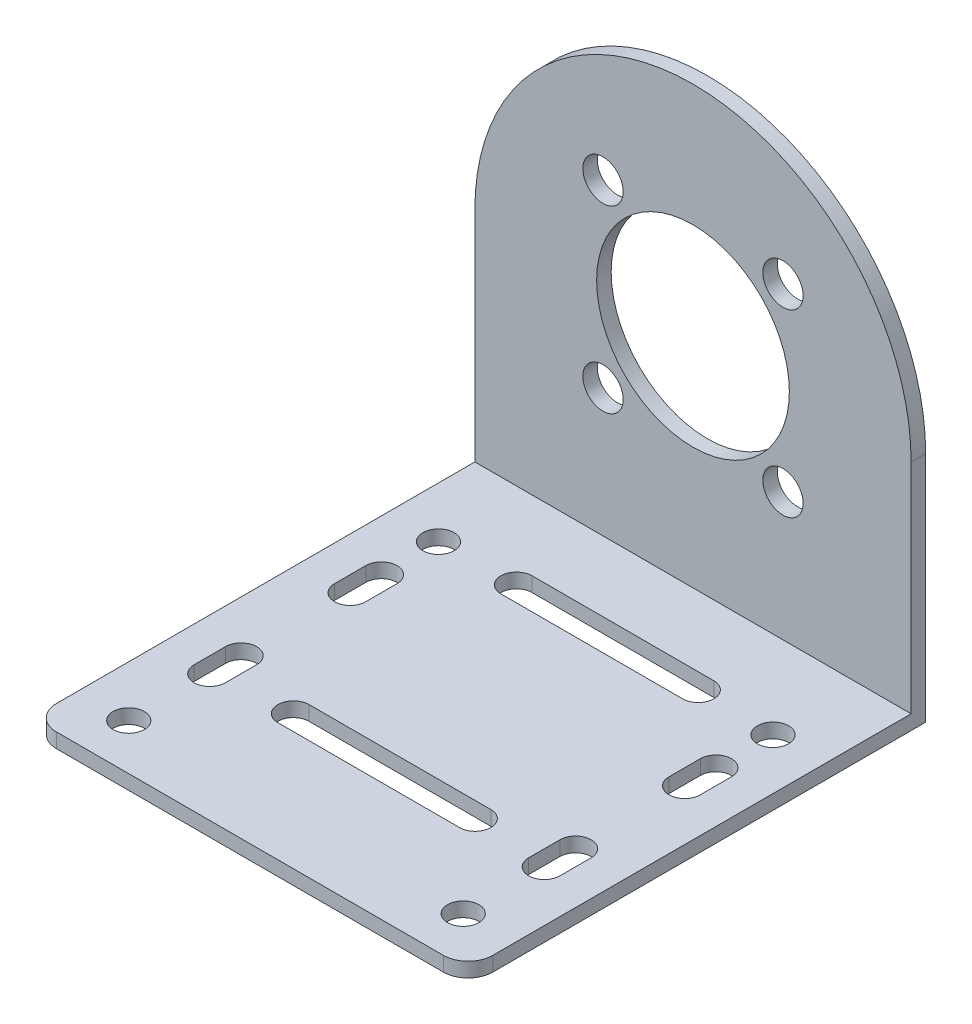
from build123d import *

# Parameters (mm, degrees)
SKETCH1_R           = 2.15
BOSS_EXTRUDE1_DEPTH = 2
SKETCH5_R           = 2.774437445
SKETCH5_R_2         = 13.25
BOSS_EXTRUDE2_DEPTH = 2


with BuildPart() as part:
    # Sketch1 → Boss-Extrude1 (new body)
    with BuildSketch(Plane(origin=(0, 0, 0), x_dir=(1, 0, 0), z_dir=(0, 1, 0))):
        with BuildLine():
            Line((-26.604565316, -31.465), (26.604565316, -31.465))
            ThreePointArc((26.604565316, -31.465), (29.005500206, -30.470500206), (30, -28.069565316))
            Line((30, -28.069565316), (30, 31.465))
            Line((30, 31.465), (-30, 31.465))
            Line((-30, 31.465), (-30, -28.069565316))
            ThreePointArc((-30, -28.069565316), (-29.005500206, -30.470500206), (-26.604565316, -31.465))
        make_face()
        with Locations(Location((-23, -25.135, 0), (0, 0, 270))):
            Circle(SKETCH1_R, mode=Mode.SUBTRACT)
        with Locations(Location((-23, 17.465, 0), (0, 0, 270))):
            Circle(SKETCH1_R, mode=Mode.SUBTRACT)
        with Locations(Location((23, -25.135, 0), (0, 0, 90))):
            Circle(SKETCH1_R, mode=Mode.SUBTRACT)
        with Locations(Location((23, 17.465, 0), (0, 0, 90))):
            Circle(SKETCH1_R, mode=Mode.SUBTRACT)
        with BuildLine():
            Line((-12.5, 19.838201533), (12.5, 19.838201533))
            ThreePointArc((12.5, 19.838201533), (14.65, 17.688201533), (12.5, 15.538201533))
            Line((12.5, 15.538201533), (-12.5, 15.538201533))
            ThreePointArc((-12.5, 15.538201533), (-14.65, 17.688201533), (-12.5, 19.838201533))
        make_face(mode=Mode.SUBTRACT)
        with BuildLine():
            Line((-20.85, 9.615), (-20.85, 5.315))
            ThreePointArc((-20.85, 5.315), (-23, 3.165), (-25.15, 5.315))
            Line((-25.15, 5.315), (-25.15, 9.615))
            ThreePointArc((-25.15, 9.615), (-23, 11.765), (-20.85, 9.615))
        make_face(mode=Mode.SUBTRACT)
        with BuildLine():
            Line((-20.85, -9.685), (-20.85, -13.985))
            ThreePointArc((-20.85, -13.985), (-23, -16.135), (-25.15, -13.985))
            Line((-25.15, -13.985), (-25.15, -9.685))
            ThreePointArc((-25.15, -9.685), (-23, -7.535), (-20.85, -9.685))
        make_face(mode=Mode.SUBTRACT)
        with BuildLine():
            Line((-12.5, -10.835), (12.5, -10.835))
            ThreePointArc((12.5, -10.835), (14.65, -12.985), (12.5, -15.135))
            Line((12.5, -15.135), (-12.5, -15.135))
            ThreePointArc((-12.5, -15.135), (-14.65, -12.985), (-12.5, -10.835))
        make_face(mode=Mode.SUBTRACT)
        with BuildLine():
            Line((20.85, -9.685), (20.85, -13.985))
            ThreePointArc((20.85, -13.985), (23, -16.135), (25.15, -13.985))
            Line((25.15, -13.985), (25.15, -9.685))
            ThreePointArc((25.15, -9.685), (23, -7.535), (20.85, -9.685))
        make_face(mode=Mode.SUBTRACT)
        with BuildLine():
            Line((20.85, 9.615), (20.85, 5.315))
            ThreePointArc((20.85, 5.315), (23, 3.165), (25.15, 5.315))
            Line((25.15, 5.315), (25.15, 9.615))
            ThreePointArc((25.15, 9.615), (23, 11.765), (20.85, 9.615))
        make_face(mode=Mode.SUBTRACT)
    extrude(amount=BOSS_EXTRUDE1_DEPTH)

    # Sketch5 → Boss-Extrude2 (add)
    with BuildSketch(Plane(origin=(0, 0, -31.465), x_dir=(-1, 0, 0), z_dir=(0, 0, -1))):
        with BuildLine():
            ThreePointArc((-30, 32), (0, 62), (30, 32))
            Line((30, 32), (30, 2))
            Line((30, 2), (-30, 2))
            Line((-30, 2), (-30, 32))
        make_face()
        with Locations((12.374368671, 19.625631329)):
            Circle(SKETCH5_R, mode=Mode.SUBTRACT)
        with Locations((-12.374368671, 19.625631329)):
            Circle(SKETCH5_R, mode=Mode.SUBTRACT)
        with Locations((-12.374368671, 44.374368671)):
            Circle(SKETCH5_R, mode=Mode.SUBTRACT)
        with Locations((12.374368671, 44.374368671)):
            Circle(SKETCH5_R, mode=Mode.SUBTRACT)
        with Locations((0, 32)):
            Circle(SKETCH5_R_2, mode=Mode.SUBTRACT)
    extrude(amount=-BOSS_EXTRUDE2_DEPTH)


solid = part.part
